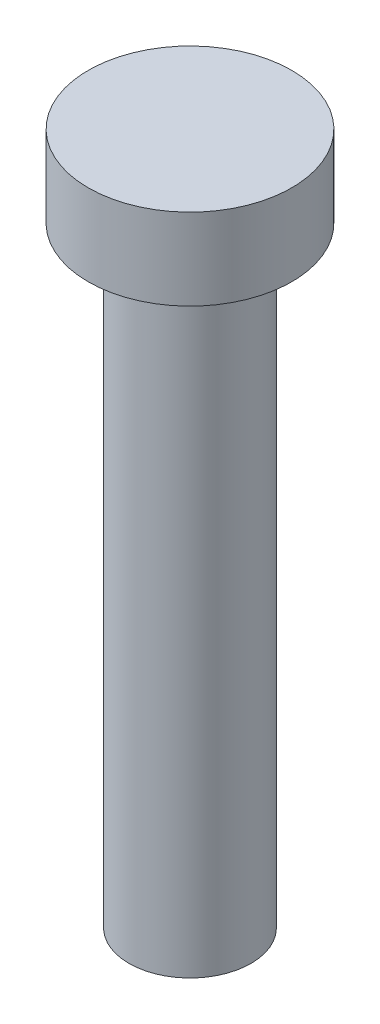
from build123d import *

# Parameters (mm, degrees)
ESQUISSE1_R      = 1.5
EXTRUSION1_DEPTH = 15
ESQUISSE2_R      = 2.5
EXTRUSION2_DEPTH = 2


with BuildPart() as part:
    # Esquisse1 → Extrusion1 (new body)
    with BuildSketch(Plane(origin=(0, 0, 0), x_dir=(1, 0, 0), z_dir=(0, 1, 0))):
        with Locations(Location((0, 0, 0), (0, 0, 270))):
            Circle(ESQUISSE1_R)
    extrude(amount=EXTRUSION1_DEPTH)

    # Esquisse2 → Extrusion2 (add)
    with BuildSketch(Plane(origin=(0, 15, 0), x_dir=(1, 0, 0), z_dir=(0, 1, 0))):
        with Locations(Location((0, 0, 0), (0, 0, 270))):
            Circle(ESQUISSE2_R)
    extrude(amount=EXTRUSION2_DEPTH)


solid = part.part
